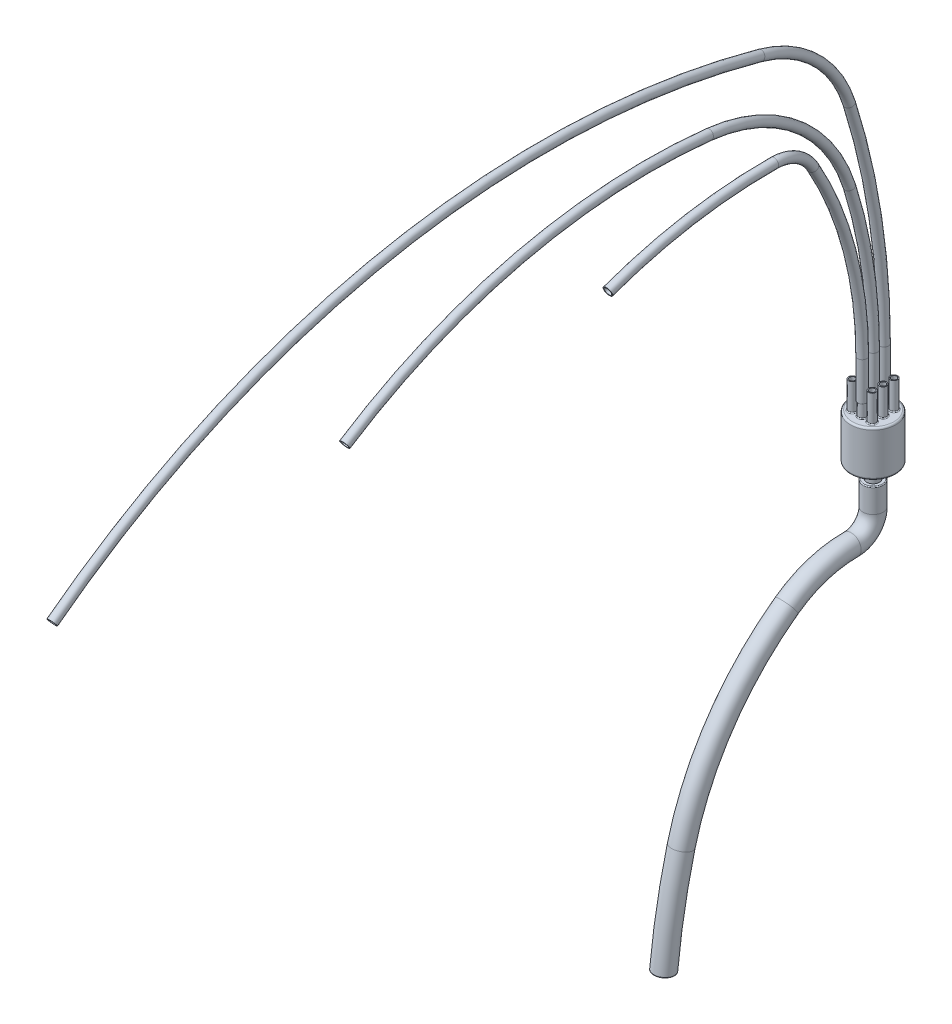
from build123d import *

# Parameters (mm, degrees)
CROQUIS1_R     = 25
EXTRUIR1_DEPTH = 25
CROQUIS2_R     = 7
EXTRUIR2_DEPTH = 40
CROQUIS3_R     = 4
EXTRUIR3_DEPTH = 30
REDONDEO1_R    = 2
VACIADO1_T     = -1
REDONDEO2_R    = 1
CROQUIS7_R     = 5
CROQUIS8_R     = 5
CROQUIS9_R     = 5
VACIADO2_T     = -1
VACIADO3_T     = -1
VACIADO4_T     = -1
CROQUIS11_R    = 11
VACIADO5_T     = -4
REDONDEO3_R    = 1


with BuildPart() as part:
    # Croquis1 → Extruir1 (new, symmetric)
    with BuildSketch(Plane(origin=(0, 0, 0), x_dir=(1, 0, 0), z_dir=(0, 1, 0))):
        with Locations(Location((0, 0, 0), (0, 0, 270))):
            Circle(CROQUIS1_R)
    extrude(amount=EXTRUIR1_DEPTH, both=True)

    # Croquis2 → Extruir2 (add)
    with BuildSketch(Plane.XZ.offset(25)):
        with Locations(Location((0, 0, 0), (0, 0, 90))):
            Circle(CROQUIS2_R)
    extrude(amount=EXTRUIR2_DEPTH)

    # Croquis3 → Extruir3 (add)
    with BuildSketch(Plane(origin=(0, 25, 0), x_dir=(1, 0, 0), z_dir=(0, 1, 0))):
        with Locations(Location((0, 0, 0), (0, 0, 270))):
            Circle(CROQUIS3_R)
        with Locations(Location((-11, 0, 0), (0, 0, 270))):
            Circle(CROQUIS3_R)
        with Locations(Location((11, 0, 0), (0, 0, 270))):
            Circle(CROQUIS3_R)
        with Locations(Location((-11, 12, 0), (0, 0, 270))):
            Circle(CROQUIS3_R)
        with Locations(Location((0, 12, 0), (0, 0, 270))):
            Circle(CROQUIS3_R)
        with Locations(Location((11, 12, 0), (0, 0, 270))):
            Circle(CROQUIS3_R)
        with Locations(Location((-11, -12, 0), (0, 0, 270))):
            Circle(CROQUIS3_R)
        with Locations(Location((11, -12, 0), (0, 0, 270))):
            Circle(CROQUIS3_R)
        with Locations(Location((0, -12, 0), (0, 0, 270))):
            Circle(CROQUIS3_R)
    extrude(amount=EXTRUIR3_DEPTH)

    # Redondeo1
    redondeo1_edges = [part.edges().sort_by_distance(p)[0] for p in [
        (0, -25, -25),
        (0, 25, -25),
    ]]
    fillet(redondeo1_edges, radius=REDONDEO1_R)

    # Vaciado1
    vaciado1_openings = [part.faces().sort_by_distance(p)[0] for p in [
        (0, 55, 0),
        (-11, 55, 0),
        (11, 55, 0),
        (0, 55, -12),
        (-11, 55, -12),
        (11, 55, -12),
        (0, 55, 12),
        (-11, 55, 12),
        (11, 55, 12),
        (0, -65, 0),
    ]]
    offset(amount=VACIADO1_T, openings=vaciado1_openings, kind=Kind.INTERSECTION)

    # Redondeo2
    redondeo2_edges = [part.edges().sort_by_distance(p)[0] for p in [
        (0, 25, -4),
        (-11, 25, -4),
        (11, 25, -4),
        (0, 25, -16),
        (-11, 25, -16),
        (11, 25, -16),
        (0, 25, 8),
        (-11, 25, 8),
        (11, 25, 8),
        (0, -25, -7),
    ]]
    fillet(redondeo2_edges, radius=REDONDEO2_R)


with BuildPart() as body_2:
    # Barrer1: sweep along a path in Croquis5
    with BuildLine(Plane(origin=(0, 0, 0), x_dir=(0, 0, -1), z_dir=(1, 0, 0))) as barrer1_path:
        Line((-12, 40), (-12, 82.205417262))
        ThreePointArc((-12, 82.205417262), (-25.884681436, 189.801600909), (-66.629018809, 290.348217391))
        ThreePointArc((-66.629018809, 290.348217391), (-84.578449168, 308.667009523), (-109.283532878, 315.553157523))
        ThreePointArc((-109.283532878, 315.553157523), (-202.425989028, 308.141251926), (-292.766817639, 284.287779056))
    # Croquis7 → Barrer1 (sweep)
    with BuildSketch(Plane(origin=(0, 40, 12), x_dir=(-1, 0, 0), z_dir=(0, 1, 0))):
        Circle(CROQUIS7_R)
    sweep(path=barrer1_path.line)

    # Vaciado2
    vaciado2_openings = [body_2.faces().sort_by_distance(p)[0] for p in [
        (0, 284.287779056, 292.766817639),
        (0, 40, 12),
    ]]
    offset(amount=VACIADO2_T, openings=vaciado2_openings, kind=Kind.INTERSECTION)


with BuildPart() as body_3:
    # Barrer2: sweep along a path in Croquis4
    with BuildLine(Plane(origin=(0, 0, 0), x_dir=(0, 0, -1), z_dir=(1, 0, 0))) as barrer2_path:
        Line((0, 40), (0, 82.356926942))
        ThreePointArc((0, 82.356926942), (-6.591396201, 168.091464106), (-26.210659921, 251.810887526))
        ThreePointArc((-26.210659921, 251.810887526), (-84.887083888, 338.319514529), (-181.301762627, 378.703607922))
        ThreePointArc((-181.301762627, 378.703607922), (-390.498040001, 365.544400957), (-583.263656038, 283.217828884))
    # Croquis8 → Barrer2 (sweep)
    with BuildSketch(Plane(origin=(0, 40, 12), x_dir=(-1, 0, 0), z_dir=(0, 1, 0))):
        with Locations((0, -12)):
            Circle(CROQUIS8_R)
    sweep(path=barrer2_path.line)

    # Vaciado3
    vaciado3_openings = [body_3.faces().sort_by_distance(p)[0] for p in [
        (0, 283.217828884, 583.263656038),
        (0, 40, 0),
    ]]
    offset(amount=VACIADO3_T, openings=vaciado3_openings, kind=Kind.INTERSECTION)


with BuildPart() as body_4:
    # Barrer3: sweep along a path in Croquis6
    with BuildLine(Plane(origin=(0, 0, 0), x_dir=(0, 0, -1), z_dir=(1, 0, 0))) as barrer3_path:
        Line((12, 40), (12, 82.356926942))
        ThreePointArc((12, 82.356926942), (2.333642897, 208.26748276), (-26.43887425, 331.227024004))
        ThreePointArc((-26.43887425, 331.227024004), (-63.562552265, 391.079861812), (-124.745459273, 425.967990924))
        ThreePointArc((-124.745459273, 425.967990924), (-533.247605401, 441.967843316), (-906.25565292, 274.650793518))
    # Croquis9 → Barrer3 (sweep)
    with BuildSketch(Plane(origin=(0, 40, 12), x_dir=(-1, 0, 0), z_dir=(0, 1, 0))):
        with Locations((0, -24)):
            Circle(CROQUIS9_R)
    sweep(path=barrer3_path.line)

    # Vaciado4
    vaciado4_openings = [body_4.faces().sort_by_distance(p)[0] for p in [
        (0, 274.650793518, 906.25565292),
        (0, 40, -12),
    ]]
    offset(amount=VACIADO4_T, openings=vaciado4_openings, kind=Kind.INTERSECTION)


with BuildPart() as body_5:
    # Barrer4: sweep along a path in Croquis10
    with BuildLine(Plane(origin=(0, 0, 0), x_dir=(0, 0, -1), z_dir=(1, 0, 0))) as barrer4_path:
        Line((0, -40.976763903), (0, -67.55706806))
        ThreePointArc((0, -67.55706806), (-7.092715083, -84.616953473), (-24.189646889, -91.619897165))
        ThreePointArc((-24.189646889, -91.619897165), (-61.60553015, -97.388415882), (-95.368437258, -114.514134317))
        ThreePointArc((-95.368437258, -114.514134317), (-168.605242835, -190.064011039), (-211.822536897, -285.999818002))
        ThreePointArc((-211.822536897, -285.999818002), (-223.62280979, -340.709524913), (-231.288289557, -396.149933375))
    # Croquis11 → Barrer4 (sweep)
    with BuildSketch(Plane.XZ.offset(40.976763903)):
        Circle(CROQUIS11_R)
    sweep(path=barrer4_path.line)

    # Vaciado5
    vaciado5_openings = [body_5.faces().sort_by_distance(p)[0] for p in [
        (0, -396.149933375, 231.288289557),
        (0, -40.976763903, 0),
    ]]
    offset(amount=VACIADO5_T, openings=vaciado5_openings, kind=Kind.INTERSECTION)

    # Redondeo3
    redondeo3_edges = [body_5.edges().sort_by_distance(p)[0] for p in [
        (-11, -40.976763903, 0),
        (-11, -396.149933375, 231.288289557),
    ]]
    fillet(redondeo3_edges, radius=REDONDEO3_R)


solid = Compound([part.part, body_2.part, body_3.part, body_4.part, body_5.part])
